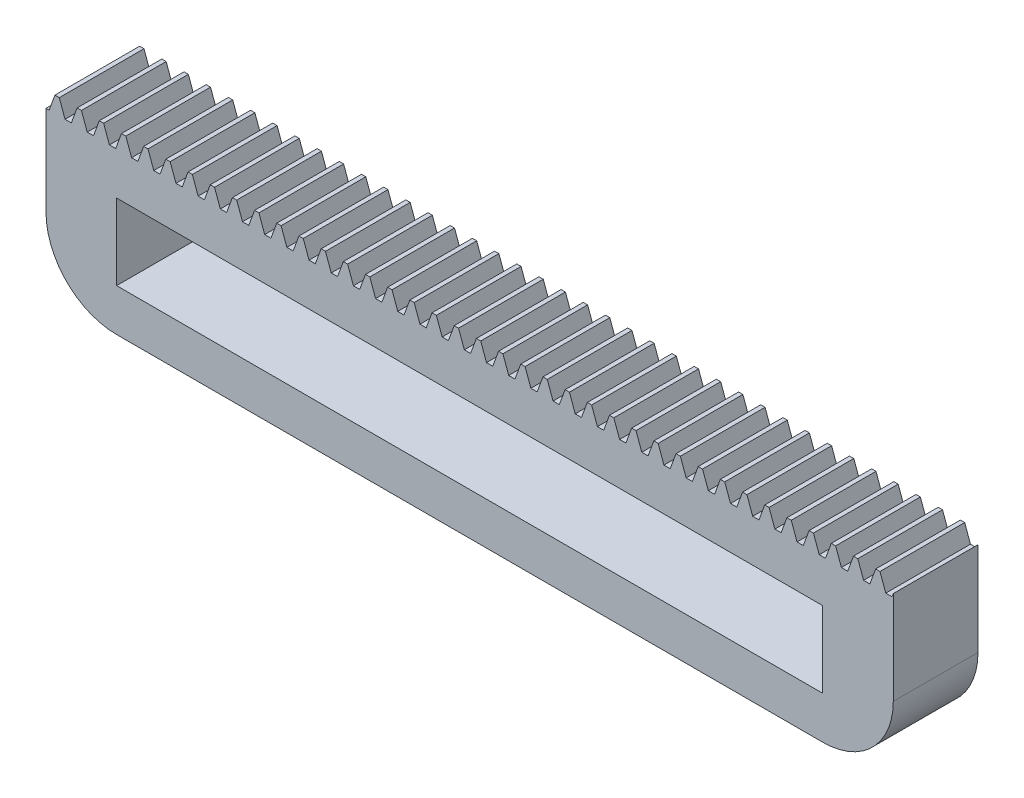
from build123d import *

# Parameters (mm, degrees)
BLANKSKE_W          = 60
BLANKSKE_H          = 12.5
BLANK_DEPTH         = 6
TOOTHCUTSIM_DEPTH   = 62.581247146
TEETHCUTS_COUNT     = 39
TEETHCUTS_PITCH     = 1.570796325
SKETCH1_W           = 60
SKETCH1_H           = 6
BOSS_EXTRUDE1_DEPTH = 10
SKETCH4_W           = 88.884112985
SKETCH4_H           = 15.47203355
CUT_EXTRUDE3_DEPTH  = 62.581247146
SKETCH3_W           = 50
SKETCH3_H           = 5.375
CUT_EXTRUDE2_DEPTH  = 10
FILLET3_R           = 5


with BuildPart() as part:
    # BlankSke → Blank (new body)
    with BuildSketch(Plane.XY):
        with Locations((30, 6.25)):
            Rectangle(BLANKSKE_W, BLANKSKE_H)
    extrude(amount=-BLANK_DEPTH)

    # TooCutSkeSim → ToothCutSim (cut, through all)
    with BuildSketch(Plane.XY):
        Polygon((0.222217685, 11.375), (-0.222217685, 11.375), (-0.640929042, 12.5254), (0.640929042, 12.5254), align=None)
    toothcutsim = extrude(amount=-TOOTHCUTSIM_DEPTH, mode=Mode.SUBTRACT)

    # TeethCuts: ToothCutSim ×39
    with Locations(*[(i * TEETHCUTS_PITCH, 0, 0) for i in range(1, TEETHCUTS_COUNT)]):
        add(toothcutsim, mode=Mode.SUBTRACT)

    # Sketch1 → Boss-Extrude1 (add)
    with BuildSketch(Plane.XZ):
        with Locations((30, -3)):
            Rectangle(SKETCH1_W, SKETCH1_H)
    extrude(amount=BOSS_EXTRUDE1_DEPTH)

    # Sketch4 → Cut-Extrude3 (cut, through all)
    with BuildSketch(Plane.XY):
        with Locations((41.448981395, -7.736016775)):
            Rectangle(SKETCH4_W, SKETCH4_H)
    extrude(amount=-CUT_EXTRUDE3_DEPTH, mode=Mode.SUBTRACT)

    # Sketch3 → Cut-Extrude2 (cut)
    with BuildSketch(Plane.XY):
        with Locations((30, 5.6875)):
            Rectangle(SKETCH3_W, SKETCH3_H)
    extrude(amount=-CUT_EXTRUDE2_DEPTH, mode=Mode.SUBTRACT)

    # Fillet3
    fillet3_edges = [part.edges().sort_by_distance(p)[0] for p in [
        (0, 0, -3),
        (60, 0, -3),
    ]]
    fillet(fillet3_edges, radius=FILLET3_R)


solid = part.part
